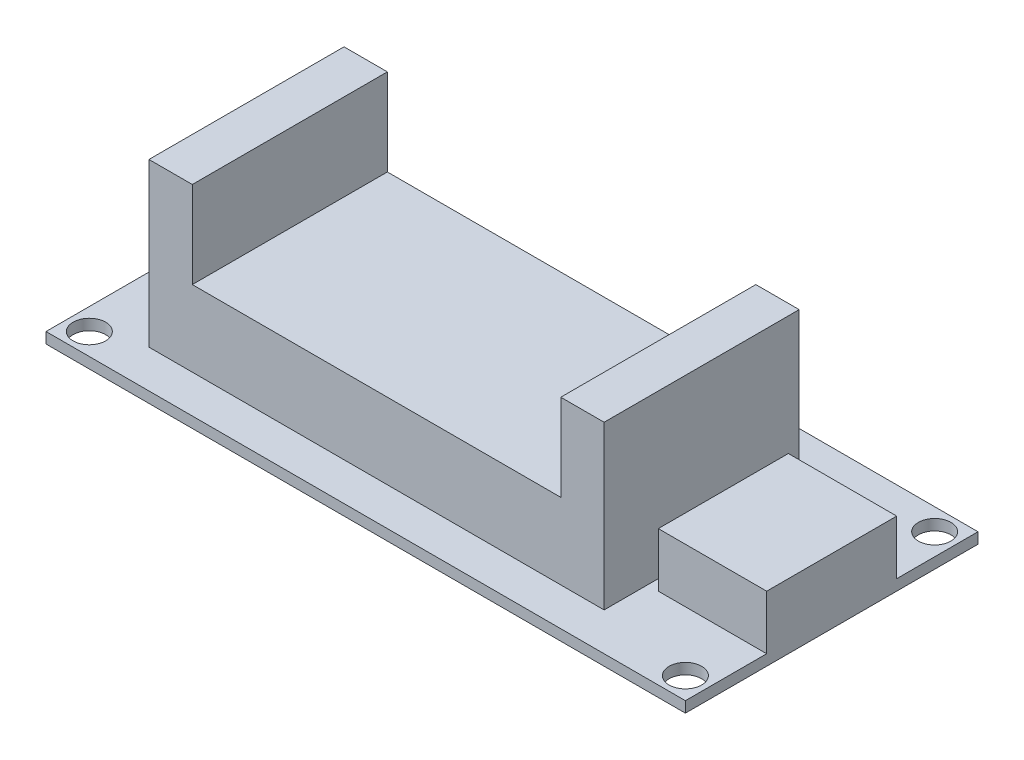
from build123d import *

# Parameters (mm, degrees)
SKETCH1_W           = 59
SKETCH1_H           = 27
SKETCH1_R           = 1.5
BOSS_EXTRUDE1_DEPTH = 1
SKETCH2_W           = 34
SKETCH2_H           = 18
BOSS_EXTRUDE2_DEPTH = 7
SKETCH3_W           = 4
SKETCH3_H           = 18
BOSS_EXTRUDE3_DEPTH = 15
SKETCH4_W           = 4
SKETCH4_H           = 18
BOSS_EXTRUDE4_DEPTH = 15
SKETCH7_W           = 10
SKETCH7_H           = 12
BOSS_EXTRUDE7_DEPTH = 5
SKETCH8_W           = 6
SKETCH8_H           = 6.85
BOSS_EXTRUDE8_DEPTH = 1.8


with BuildPart() as part:
    # Sketch1 → Boss-Extrude1 (new body)
    with BuildSketch(Plane(origin=(0, 0, 0), x_dir=(1, 0, 0), z_dir=(0, 1, 0))):
        with Locations((1.308219178, 7.805712308)):
            Rectangle(SKETCH1_W, SKETCH1_H)
        with Locations(Location((-26.191780822, -3.694287692, 0), (0, 0, 270))):
            Circle(SKETCH1_R, mode=Mode.SUBTRACT)
        with Locations(Location((-26.191780822, 19.305712308, 0), (0, 0, 270))):
            Circle(SKETCH1_R, mode=Mode.SUBTRACT)
        with Locations(Location((28.808219178, 19.305712308, 0), (0, 0, 270))):
            Circle(SKETCH1_R, mode=Mode.SUBTRACT)
        with Locations(Location((28.808219178, -3.694287692, 0), (0, 0, 270))):
            Circle(SKETCH1_R, mode=Mode.SUBTRACT)
    extrude(amount=BOSS_EXTRUDE1_DEPTH)

    # Sketch2 → Boss-Extrude2 (add)
    with BuildSketch(Plane(origin=(0, 1, 0), x_dir=(1, 0, 0), z_dir=(0, 1, 0))):
        with Locations((-1.191780822, 6.805712308)):
            Rectangle(SKETCH2_W, SKETCH2_H)
    extrude(amount=BOSS_EXTRUDE2_DEPTH)

    # Sketch3 → Boss-Extrude3 (add)
    with BuildSketch(Plane(origin=(0, 1, 0), x_dir=(1, 0, 0), z_dir=(0, 1, 0))):
        with Locations((-20.191780822, 6.805712308)):
            Rectangle(SKETCH3_W, SKETCH3_H)
    extrude(amount=BOSS_EXTRUDE3_DEPTH)

    # Sketch4 → Boss-Extrude4 (add)
    with BuildSketch(Plane(origin=(0, 1, 0), x_dir=(1, 0, 0), z_dir=(0, 1, 0))):
        with Locations((17.808219178, 6.805712308)):
            Rectangle(SKETCH4_W, SKETCH4_H)
    extrude(amount=BOSS_EXTRUDE4_DEPTH)

    # Sketch7 → Boss-Extrude7 (add)
    with BuildSketch(Plane(origin=(0, 1, 0), x_dir=(1, 0, 0), z_dir=(0, 1, 0))):
        with Locations((25.808219178, 7.805712308)):
            Rectangle(SKETCH7_W, SKETCH7_H)
    extrude(amount=BOSS_EXTRUDE7_DEPTH)

    # Sketch8 → Boss-Extrude8 (add)
    with BuildSketch(Plane(origin=(0, 1, 0), x_dir=(1, 0, 0), z_dir=(0, 1, 0))):
        with Locations((-25.191780822, 7.805712308)):
            Rectangle(SKETCH8_W, SKETCH8_H)
    extrude(amount=BOSS_EXTRUDE8_DEPTH)


solid = part.part
